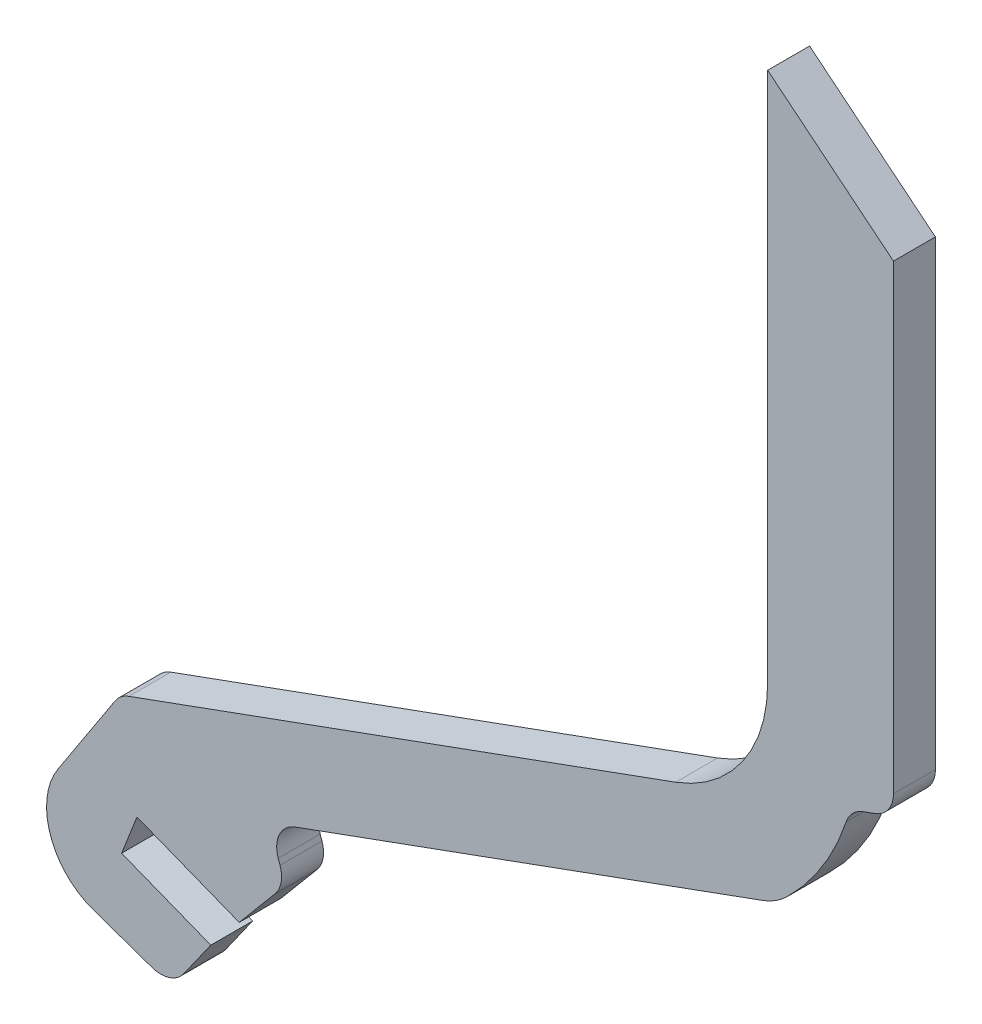
from build123d import *

# Parameters (mm, degrees)
BASE_EXTRUDE_DEPTH = 3


with BuildPart() as part:
    # Sketch1 → Base-Extrude (new body)
    with BuildSketch(Plane.XY):
        with BuildLine():
            Line((732.034300263, -38.701536799), (738.412696802, -41.20669573))
            Line((738.412696802, -41.20669573), (736.473436897, -43.947731787))
            ThreePointArc((736.473436897, -43.947731787), (735.449310633, -44.697774319), (734.180021911, -44.680323155))
            Line((734.180021911, -44.680323155), (730.013302653, -43.221928834))
            ThreePointArc((730.013302653, -43.221928834), (726.93179591, -40.113817439), (727.477141983, -35.771164112))
            Line((727.477141983, -35.771164112), (731.560851868, -29.509962721))
            ThreePointArc((731.560851868, -29.509962721), (731.992554194, -29.036110484), (732.551993885, -28.723172671))
            Line((732.551993885, -28.723172671), (771.665266629, -14.487105627))
            ThreePointArc((771.665266629, -14.487105627), (776.436585639, -10.825943783), (778.245065196, -5.090179419))
            Line((778.245065196, -5.090179419), (778.245065196, 32.909820581))
            Line((778.245065196, 32.909820581), (787.245065196, 25.583892383))
            Line((787.245065196, 25.583892383), (787.245065196, -7.416107617))
            ThreePointArc((787.245065196, -7.416107617), (786.883369284, -8.563260489), (785.929105482, -9.295492858))
            Line((785.929105482, -9.295492858), (785.06938995, -9.608403722))
            ThreePointArc((785.06938995, -9.608403722), (784.319331429, -10.093744269), (783.855426973, -10.857246649))
            ThreePointArc((783.855426973, -10.857246649), (782.140163623, -14.493920417), (779.609772484, -17.618763634))
            ThreePointArc((779.609772484, -17.618763634), (778.800038242, -18.253560622), (777.875517606, -18.705111674))
            Line((777.875517606, -18.705111674), (744.440455722, -30.874478981))
            ThreePointArc((744.440455722, -30.874478981), (743.317578976, -31.896513164), (743.236121599, -33.412682929))
            Line((743.236121599, -33.412682929), (743.365082604, -33.782324318))
            ThreePointArc((743.365082604, -33.782324318), (743.443954805, -34.801616013), (743.008797081, -35.726718244))
            Line((743.008797081, -35.726718244), (740.445206883, -38.781886072))
            Line((740.445206883, -38.781886072), (733.131014766, -35.909187018))
            Line((733.131014766, -35.909187018), (732.034300263, -38.701536799))
        make_face()
    extrude(amount=BASE_EXTRUDE_DEPTH)


solid = part.part
